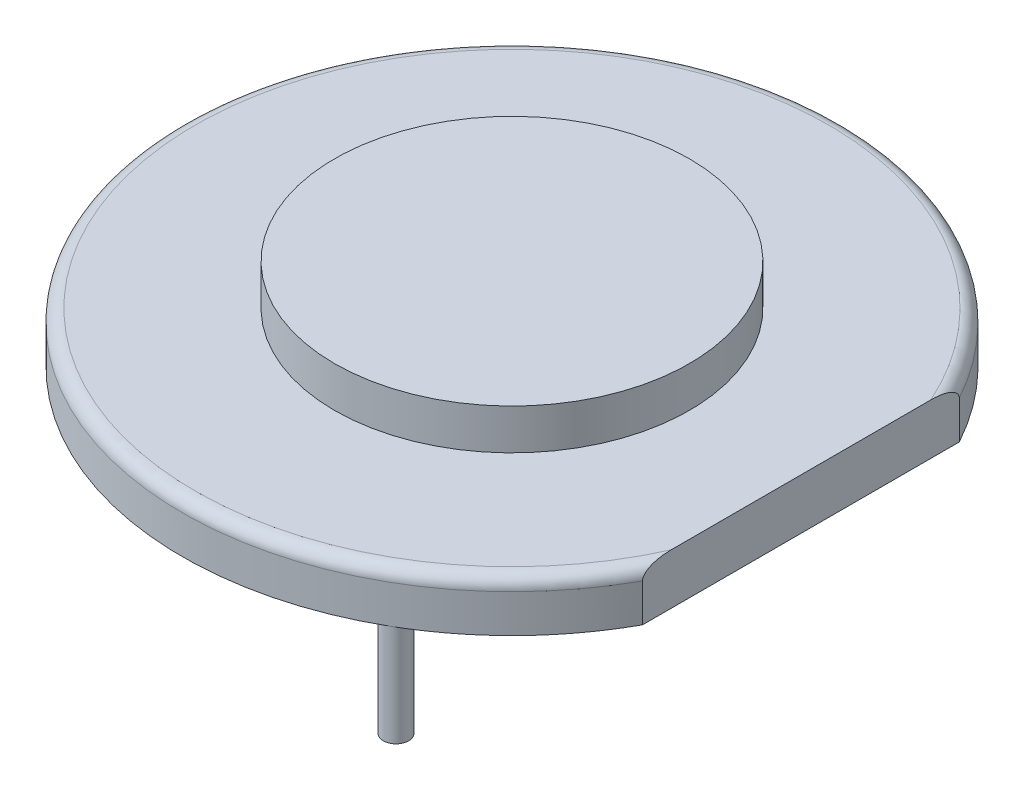
from build123d import *

# Parameters (mm, degrees)
SKETCH1_R           = 3.5
BOSS_EXTRUDE1_DEPTH = 0.8
SKETCH2_R           = 6.5
BOSS_EXTRUDE2_DEPTH = 1
CUT_EXTRUDE1_START  = -1
CUT_EXTRUDE1_DEPTH  = 1
SKETCH7_R           = 0.25
BOSS_EXTRUDE6_DEPTH = 2
FILLET2_R           = 0.25


with BuildPart() as part:
    # Sketch1 → Boss-Extrude1 (new body)
    with BuildSketch(Plane(origin=(0, 0, 0), x_dir=(1, 0, 0), z_dir=(0, 1, 0))):
        with Locations(Location((0, 0, 0), (0, 0, 270))):
            Circle(SKETCH1_R)
    extrude(amount=BOSS_EXTRUDE1_DEPTH)

    # Sketch2 → Boss-Extrude2 (add)
    with BuildSketch(Plane.XZ):
        with Locations(Location((0, 0, 0), (0, 0, 270))):
            Circle(SKETCH2_R)
    extrude(amount=BOSS_EXTRUDE2_DEPTH)

    # Sketch3 → Cut-Extrude1 (cut)
    with BuildSketch(Plane.XZ.offset(1).offset(CUT_EXTRUDE1_START)):
        with BuildLine():
            Line((5.7, 3.12409987), (5.7, 0))
            Line((5.7, 0), (5.7, -3.12409987))
            ThreePointArc((5.7, -3.12409987), (6.296824597, -1.61245155), (6.5, 0))
            ThreePointArc((6.5, 0), (6.296824597, 1.61245155), (5.7, 3.12409987))
        make_face()
    extrude(amount=CUT_EXTRUDE1_DEPTH, mode=Mode.SUBTRACT)

    # Sketch7 → Boss-Extrude6 (add)
    with BuildSketch(Plane.XZ.offset(1)):
        with Locations(Location((-6.25, 0, 0), (0, 0, 179.998347336))):
            Circle(SKETCH7_R)
        with Locations(Location((3.125, 5.412658774, 0), (0, 0, 59.998347336))):
            Circle(SKETCH7_R)
        with Locations(Location((3.125, -5.412658774, 0), (0, 0, 299.998347346))):
            Circle(SKETCH7_R)
    extrude(amount=BOSS_EXTRUDE6_DEPTH)

    # Fillet2
    fillet2_edges = [part.edges().sort_by_distance(p)[0] for p in [
        (-6.5, 0, 0),
    ]]
    fillet(fillet2_edges, radius=FILLET2_R)


solid = part.part
